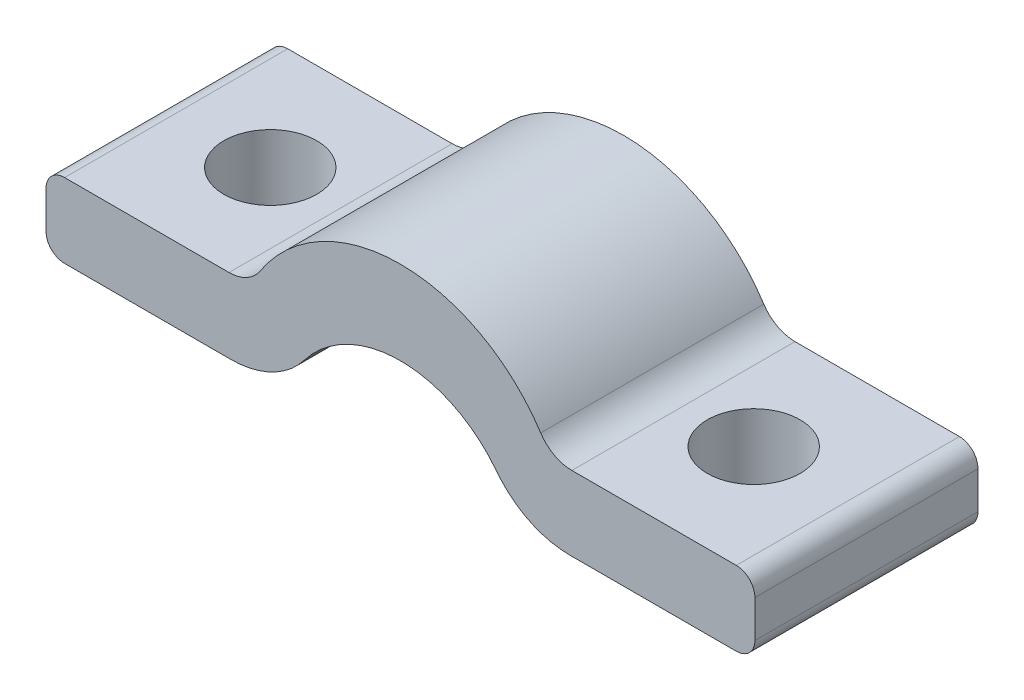
from build123d import *

# Parameters (mm, degrees)
BOSS_EXTRUDE1_DEPTH = 6
SKETCH2_R           = 1.25
CUT_EXTRUDE1_DEPTH  = 10
FILLET1_R           = 1
FILLET2_R           = 0.5
FILLET3_R           = 2.5


with BuildPart() as part:
    # Sketch1 → Boss-Extrude1 (new body)
    with BuildSketch(Plane.XY):
        with BuildLine():
            Line((-3.092329219, 1), (-9.531128874, 1))
            Line((-9.531128874, 1), (-9.531128874, 3))
            Line((-9.531128874, 3), (-4.031128874, 3))
            ThreePointArc((-4.031128874, 3), (0, 5.5), (4.031128874, 3))
            Line((4.031128874, 3), (9.531128874, 3))
            Line((9.531128874, 3), (9.531128874, 1))
            Line((9.531128874, 1), (3.092329219, 1))
            ThreePointArc((3.092329219, 1), (0, 3.25), (-3.092329219, 1))
        make_face()
    extrude(amount=BOSS_EXTRUDE1_DEPTH)

    # Sketch2 → Cut-Extrude1 (cut)
    with BuildSketch(Plane(origin=(0, 3, 0), x_dir=(1, 0, 0), z_dir=(0, 1, 0))):
        with Locations(Location((-6.5, -3, 0), (0, 0, 270))):
            Circle(SKETCH2_R)
        with Locations(Location((6.5, -3, 0), (0, 0, 270))):
            Circle(SKETCH2_R)
    extrude(amount=-CUT_EXTRUDE1_DEPTH, mode=Mode.SUBTRACT)

    # Fillet1
    fillet1_edges = [part.edges().sort_by_distance(p)[0] for p in [
        (-4.031128874, 3, 3),
        (4.031128874, 3, 3),
    ]]
    fillet(fillet1_edges, radius=FILLET1_R)

    # Fillet2
    fillet2_edges = [part.edges().sort_by_distance(p)[0] for p in [
        (-9.531128874, 1, 3),
        (-9.531128874, 3, 3),
        (9.531128874, 3, 3),
        (9.531128874, 1, 3),
    ]]
    fillet(fillet2_edges, radius=FILLET2_R)

    # Fillet3
    fillet3_edges = [part.edges().sort_by_distance(p)[0] for p in [
        (-3.092329219, 1, 3),
        (3.092329219, 1, 3),
    ]]
    fillet(fillet3_edges, radius=FILLET3_R)


solid = part.part
